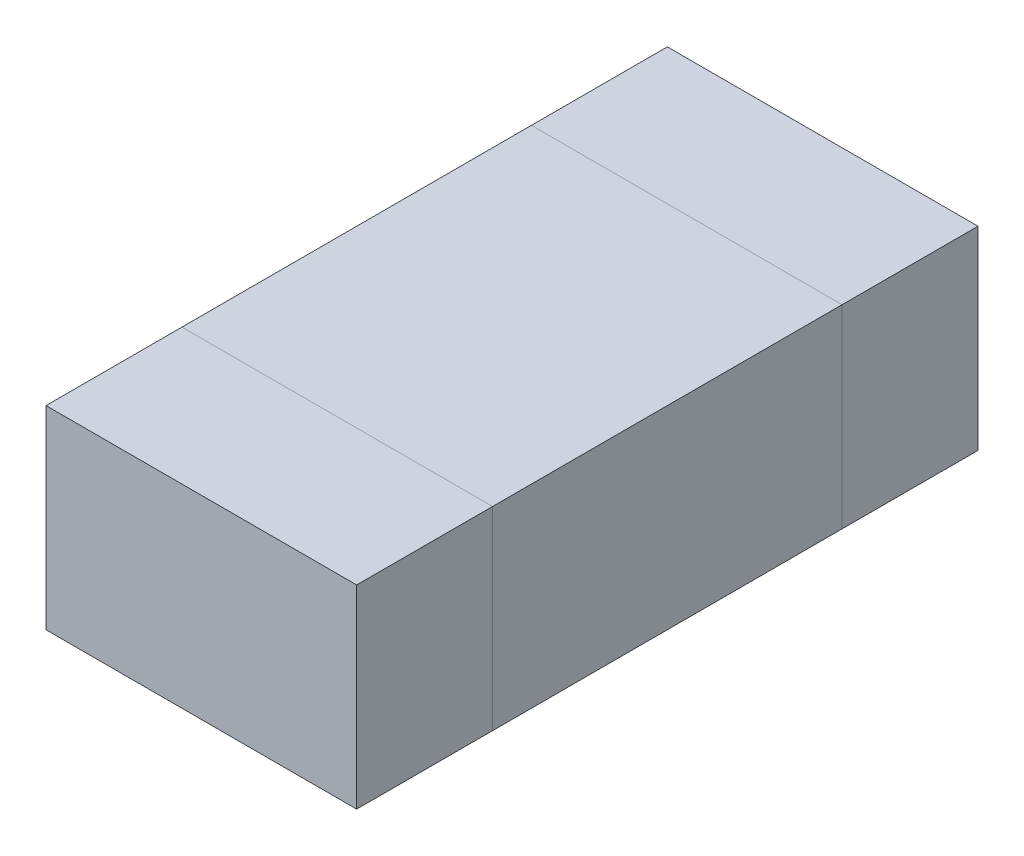
from build123d import *

# Parameters (mm, degrees)
SKETCH1_W  = 1.6
SKETCH1_H  = 1.8
MB_DEPTH   = 1
SKETCH2_W  = 1.6
SKETCH2_H  = 1
SB_L_DEPTH = 0.7
SKETCH3_W  = 1.6
SKETCH3_H  = 1
SB_R_DEPTH = 0.7


with BuildPart() as part:
    # Sketch1 → MB (new body)
    with BuildSketch(Plane(origin=(0, 0, 0), x_dir=(1, 0, 0), z_dir=(0, 1, 0))):
        Rectangle(SKETCH1_W, SKETCH1_H)
    extrude(amount=MB_DEPTH)


with BuildPart() as body_2:
    # Sketch2 → SB L (new body)
    with BuildSketch(Plane.XY.offset(0.9)):
        with Locations((0, 0.5)):
            Rectangle(SKETCH2_W, SKETCH2_H)
    extrude(amount=SB_L_DEPTH)


with BuildPart() as body_3:
    # Sketch3 → SB R (new body)
    with BuildSketch(Plane(origin=(0, 0, -0.9), x_dir=(-1, 0, 0), z_dir=(0, 0, -1))):
        with Locations((0, 0.5)):
            Rectangle(SKETCH3_W, SKETCH3_H)
    extrude(amount=SB_R_DEPTH)


solid = Compound([part.part, body_2.part, body_3.part])
